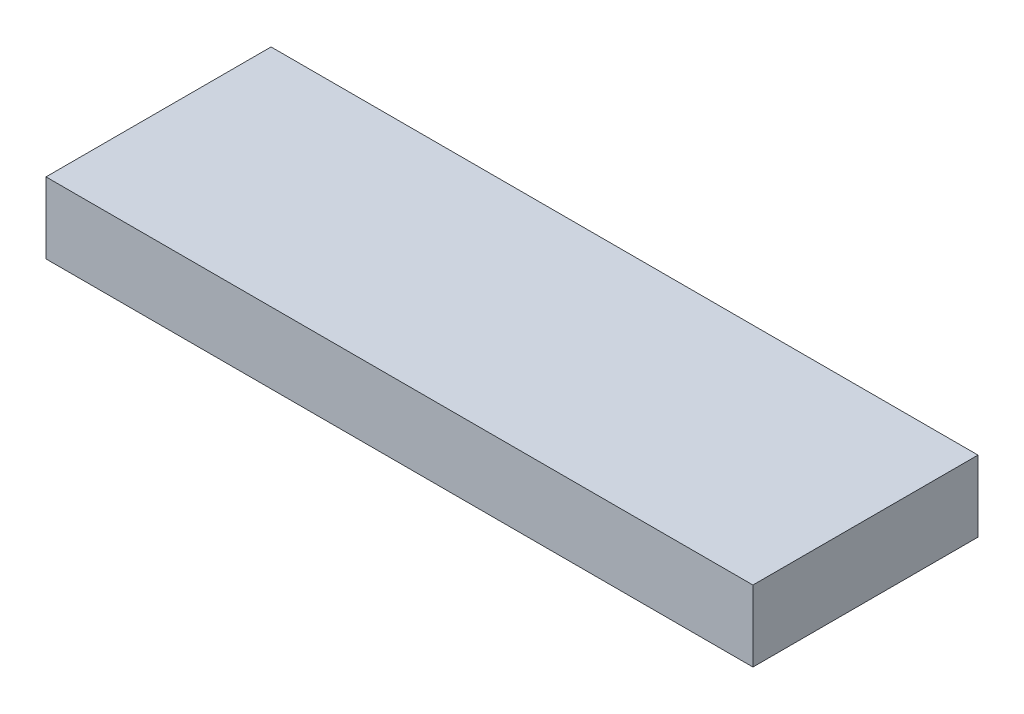
from build123d import *

# Parameters (mm, degrees)
SKETCH1_W           = 189.477532672
SKETCH1_H           = 19.05
BOSS_EXTRUDE1_DEPTH = 60.325


with BuildPart() as part:
    # Sketch1 → Boss-Extrude1 (new body)
    with BuildSketch(Plane.XY):
        with Locations((0, -273.05)):
            Rectangle(SKETCH1_W, SKETCH1_H)
    extrude(amount=BOSS_EXTRUDE1_DEPTH)


solid = part.part
